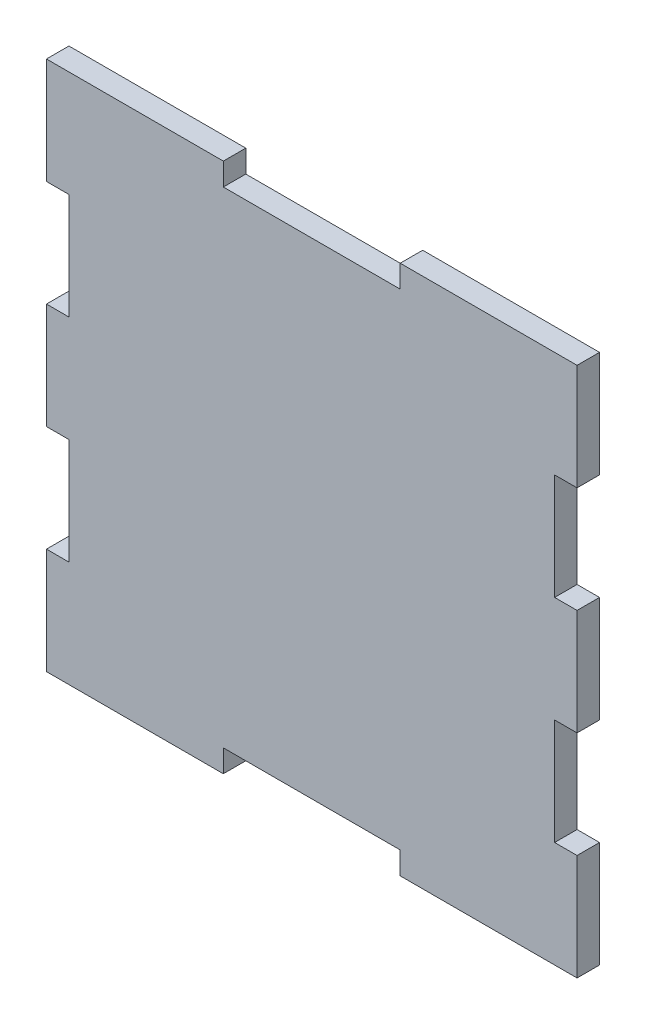
from build123d import *

# Parameters (mm, degrees)
BOSS_EXTRUDE1_DEPTH = 6.35


with BuildPart() as part:
    # Sketch2 → Boss-Extrude1 (new body)
    with BuildSketch(Plane.XY):
        Polygon((-7.205623902, 187.891798144), (-7.205623902, 157.891798144), (-0.855623902, 157.891798144), (-0.855623902, 127.891798144), (-7.205623902, 127.891798144), (-7.205623902, 97.891798144), (-0.855623902, 97.891798144), (-0.855623902, 67.891798144), (-7.205623902, 67.891798144), (-7.205623902, 37.891798144), (42.794376098, 37.891798144), (42.794376098, 44.241798144), (92.794376098, 44.241798144), (92.794376098, 37.891798144), (142.794376098, 37.891798144), (142.794376098, 67.891798144), (136.444376098, 67.891798144), (136.444376098, 97.891798144), (142.794376098, 97.891798144), (142.794376098, 127.891798144), (136.444376098, 127.891798144), (136.444376098, 157.891798144), (142.794376098, 157.891798144), (142.794376098, 187.891798144), (92.794376098, 187.891798144), (92.794376098, 181.541798144), (42.794376098, 181.541798144), (42.794376098, 187.891798144), align=None)
    extrude(amount=BOSS_EXTRUDE1_DEPTH)


solid = part.part
